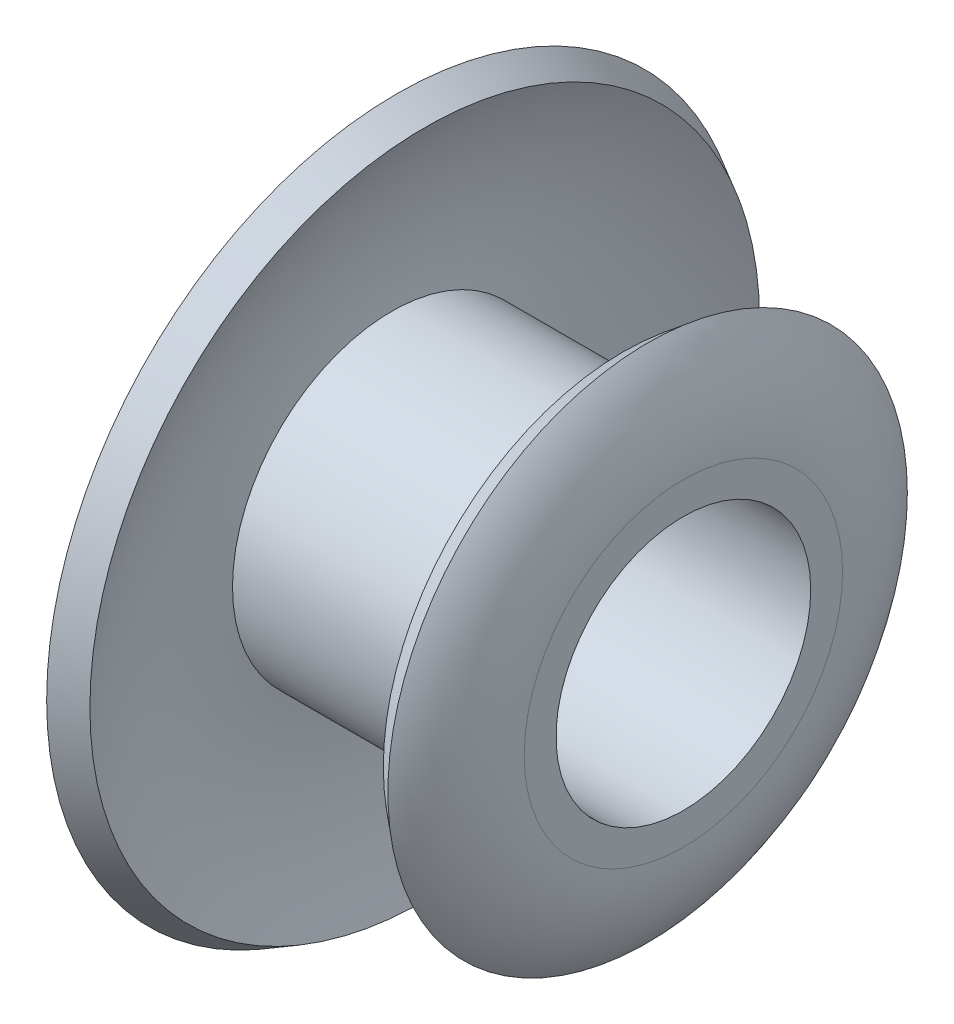
from build123d import *


with BuildPart() as part:
    # Sketch1 → Revolve1 (revolve)
    with BuildSketch(Plane.XY, mode=Mode.PRIVATE) as revolve1_sk:
        with BuildLine():
            ThreePointArc((0, 1.25), (-0.057874055, 1.58525916), (-0.224797408, 1.881712705))
            Line((-0.224797408, 1.881712705), (-0.03099676, 2.039640881))
            ThreePointArc((-0.03099676, 2.039640881), (0.177657431, 1.66907395), (0.25, 1.25))
            Line((0.25, 1.25), (0.25, 1))
            Line((0.25, 1), (0, 1))
            Line((0, 1), (-2, 1))
            Line((-2, 1), (-2.25, 1))
            ThreePointArc((-2.25, 1), (-2.284841337, 1.897834477), (-2, 2.75))
            Line((-2, 2.75), (-1.78099676, 2.629428109))
            ThreePointArc((-1.78099676, 2.629428109), (-2.021139042, 1.960479194), (-2.040639843, 1.25))
            Line((-2.040639843, 1.25), (0, 1.25))
        make_face()
    revolve(revolve1_sk.sketch.rotate(Axis((0, 0, 0), (-1, 0, 0)), 90), axis=Axis((0, 0, 0), (-1, 0, 0)))


solid = part.part
